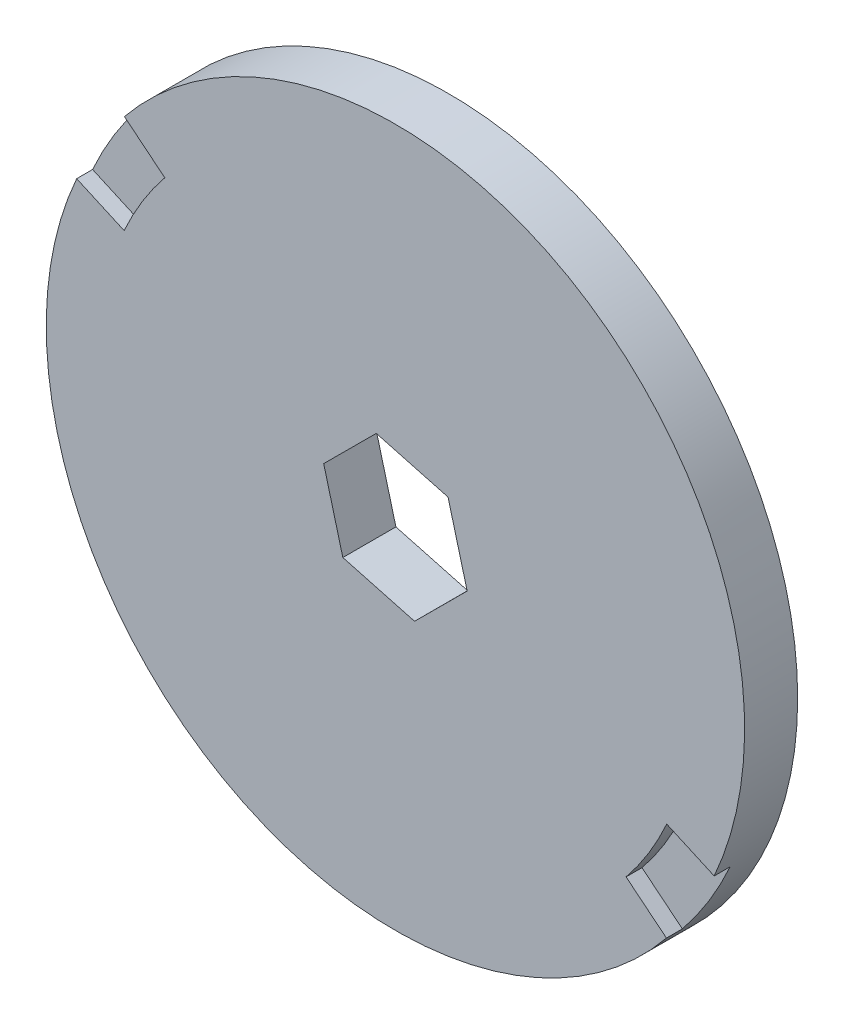
from build123d import *

# Parameters (mm, degrees)
SKETCH_1_R               = 32.9
EXTRUDE_1_DEPTH          = 5
CUT_EXTRUDE_START        = -1.5
CUT_EXTRUDE_1_DEPTH      = 1.5
PATTERN_CIRCULAR_1_COUNT = 2


with BuildPart() as part:
    # 草图1 → 凸台-拉伸1 (new body)
    with BuildSketch(Plane.XY):
        Circle(SKETCH_1_R)
        Polygon((6.759189323, -1.820263634), (4.95598921, 4.943497845), (-1.803200113, 6.76376148), (-6.759189323, 1.820263634), (-4.95598921, -4.943497845), (1.803200113, -6.76376148), align=None, mode=Mode.SUBTRACT)
    extrude(amount=EXTRUDE_1_DEPTH)

    # 草图2 → 切除-拉伸1 (cut)
    with BuildSketch(Plane.XY.offset(5).offset(CUT_EXTRUDE_START)):
        with BuildLine():
            Line((-30.032915542, 13.432571759), (-25.559928121, 11.431975965))
            ThreePointArc((-25.559928121, 11.431975965), (-23.8490871, 14.670413917), (-21.730181587, 17.657837019))
            Line((-21.730181587, 17.657837019), (-25.532963365, 20.747958497))
            ThreePointArc((-25.532963365, 20.747958497), (-28.022677343, 17.237736352), (-30.032915542, 13.432571759))
        make_face()
    cut_extrude_1 = extrude(amount=CUT_EXTRUDE_1_DEPTH, mode=Mode.SUBTRACT)

    # 阵列(圆周)1: 切除-拉伸1 ×2 about axis
    pattern_circular_1_axis = Axis((0, 0, 0), (0, 0, 1))
    for i in range(1, PATTERN_CIRCULAR_1_COUNT):
        add(cut_extrude_1.rotate(pattern_circular_1_axis, i * 360 / PATTERN_CIRCULAR_1_COUNT), mode=Mode.SUBTRACT)


solid = part.part
